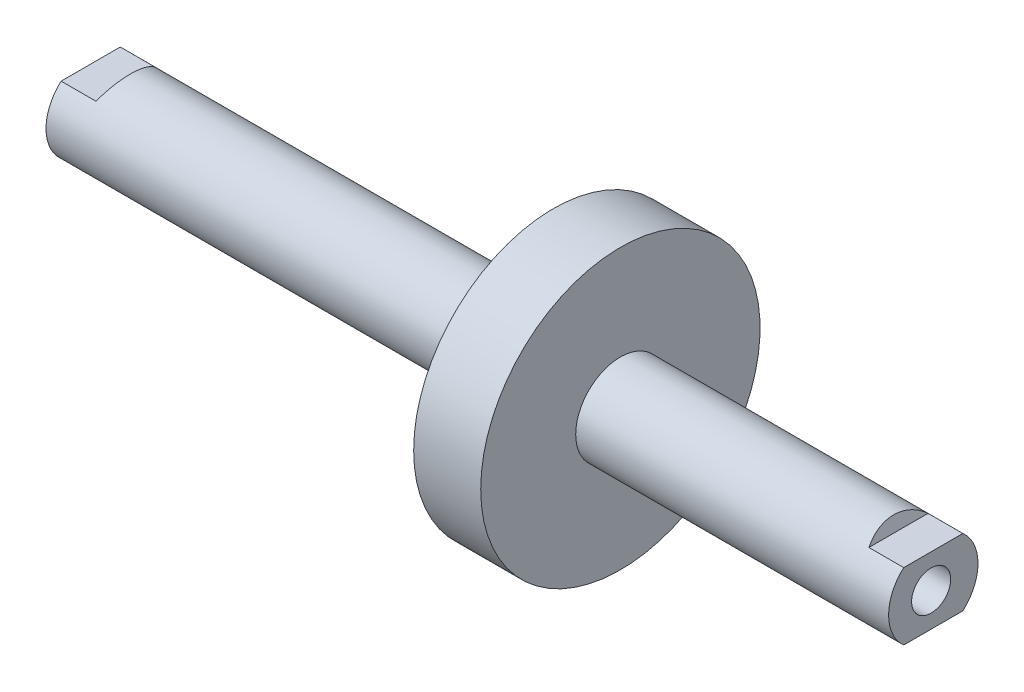
from build123d import *

# Parameters (mm, degrees)
SKETCH_2_R          = 1.75
CUT_EXTRUDE_1_DEPTH = 12
SKETCH_3_R          = 1.75
CUT_EXTRUDE_2_DEPTH = 12
CUT_EXTRUDE_5_DEPTH = 6


with BuildPart() as part:
    # 草图1 → 旋转1 (revolve)
    with BuildSketch(Plane(origin=(0, 0, 0), x_dir=(1, 0, 0), z_dir=(0, 1, 0)), mode=Mode.PRIVATE) as revolve_1_sk:
        Polygon((-41.4, 0.193025833), (-41.4, 4.193025833), (0, 4.193025833), (0, 12.693025833), (6, 12.693025833), (6, 4.193025833), (34, 4.193025833), (34, 0.193025833), align=None)
    revolve(revolve_1_sk.sketch.rotate(Axis((-41.4, 0, -0.193025833), (1, 0, 0)), 180), axis=Axis((-41.4, 0, -0.193025833), (1, 0, 0)))

    # 草图2 → 拉伸1 (cut)
    with BuildSketch(Plane(origin=(34, 0, 0), x_dir=(0, 0, -1), z_dir=(1, 0, 0))):
        Circle(SKETCH_2_R)
    extrude(amount=-CUT_EXTRUDE_1_DEPTH, mode=Mode.SUBTRACT)

    # 草图3 → 拉伸2 (cut)
    with BuildSketch(Plane.ZY.offset(41.4)):
        with Locations((-0.193025833, 0)):
            Circle(SKETCH_3_R)
    extrude(amount=-CUT_EXTRUDE_2_DEPTH, mode=Mode.SUBTRACT)

    # 草图4 → 拉伸5 (cut, symmetric)
    with BuildSketch(Plane.XY):
        Polygon((-41.4, 4), (-41.4, 3), (-38.2827279, 3), (-37.855795833, 4), align=None)
        Polygon((34, 4), (30.455795833, 4), (30.8827279, 3), (34, 3), align=None)
        Polygon((-41.4, -4), (-41.4, -3), (-38.2827279, -3), (-37.855795833, -4), align=None)
        Polygon((30.8827279, -3), (34, -3), (34, -4), (30.455795833, -4), align=None)
    extrude(amount=CUT_EXTRUDE_5_DEPTH, both=True, mode=Mode.SUBTRACT)


solid = part.part
